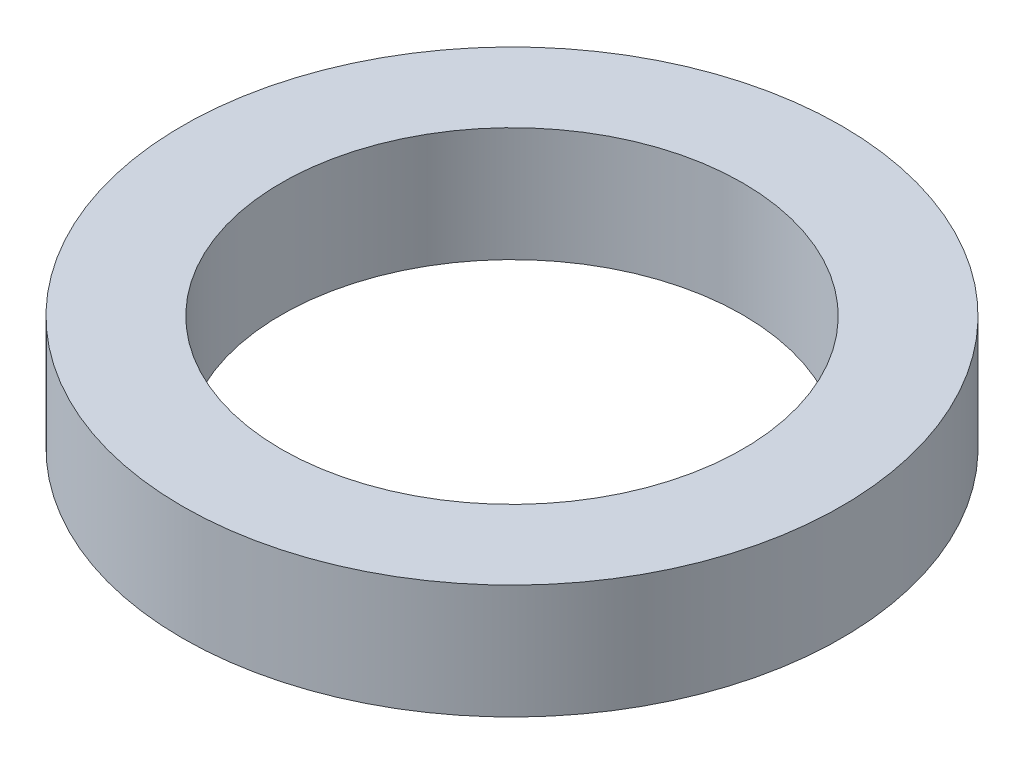
from build123d import *

# Parameters (mm, degrees)
SKETCH1_R           = 3.81
SKETCH1_R_2         = 2.667
BOSS_EXTRUDE1_DEPTH = 1.3208


with BuildPart() as part:
    # Sketch1 → Boss-Extrude1 (new body)
    with BuildSketch(Plane(origin=(0, 0, 0), x_dir=(1, 0, 0), z_dir=(0, 1, 0))):
        with Locations(Location((0, 0, 0), (0, 0, 270))):
            Circle(SKETCH1_R)
        with Locations(Location((0, 0, 0), (0, 0, 270))):
            Circle(SKETCH1_R_2, mode=Mode.SUBTRACT)
    extrude(amount=BOSS_EXTRUDE1_DEPTH)


solid = part.part
